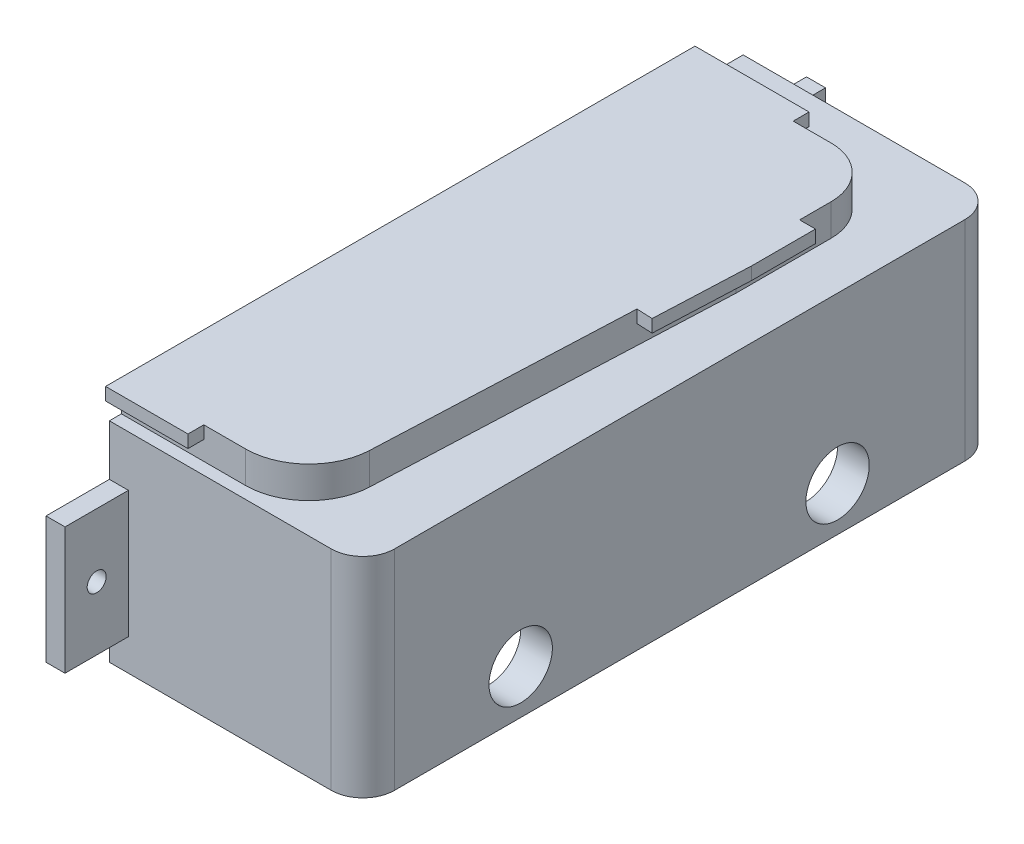
from build123d import *

# Parameters (mm, degrees)
SKETCH8_R                        = 10
BOSS_EXTRUDE6_DEPTH              = 5
BOSS_EXTRUDE7_START              = 5
BOSS_EXTRUDE7_DEPTH              = 5
EXTRUDE_THIN4_DEPTH              = 8
EXTRUDE_THIN4_DEPTH_BACK         = 20
SKETCH2_W                        = 70
SKETCH2_H                        = 90
BOSS_EXTRUDE8_DEPTH              = 5
BOSS_EXTRUDE9_DEPTH              = 5
BOSS_EXTRUDE10_REACH             = 81.849
SKETCH13_W                       = 6.5
SKETCH13_H                       = 17.8
SKETCH13_W_2                     = 6.3
BOSS_EXTRUDE10_DIRECTION_2_REACH = 81.849
SKETCH15_R                       = 2
CUT_EXTRUDE1_DEPTH               = 17.8
SKETCH17_W                       = 36
SKETCH17_H                       = 3
SKETCH17_W_2                     = 26
BOSS_EXTRUDE11_DEPTH             = 2
SKETCH18_W                       = 36
SKETCH18_H                       = 3
SKETCH18_W_2                     = 26
BOSS_EXTRUDE12_DEPTH             = 2
BOSS_EXTRUDE13_DEPTH             = 3
BOSS_EXTRUDE13_DEPTH_BACK        = 3
SKETCH19_W                       = 10
SKETCH19_H                       = 20
SKETCH19_R                       = 1.5
SKETCH21_R                       = 2.5
CUT_EXTRUDE5_DEPTH               = 8
SKETCH23_R                       = 2.5
CUT_EXTRUDE6_DEPTH               = 8
SKETCH24_W                       = 150
SKETCH24_H                       = 150
CUT_EXTRUDE7_DEPTH               = 85.574286873
SKETCH25_W                       = 150
SKETCH25_H                       = 150
CUT_EXTRUDE8_DEPTH               = 87.935665869
SKETCH26_W                       = 7.16
SKETCH26_H                       = 6.5
SKETCH26_W_2                     = 6.3
SKETCH26_H_2                     = 6.3
BOSS_EXTRUDE14_DEPTH             = 6.1
SKETCH27_R                       = 2
CUT_EXTRUDE9_DEPTH               = 8
SKETCH28_W                       = 15
SKETCH28_H                       = 13.4
BOSS_EXTRUDE15_DEPTH             = 15
CUT_EXTRUDE10_DEPTH              = 87.935665869
CUT_EXTRUDE10_DEPTH_BACK         = 87.935665869
SKETCH29_R                       = 5


with BuildPart() as part:
    # Sketch8 → Boss-Extrude6 (new body)
    with BuildSketch(Plane(origin=(0, 0, 0), x_dir=(-1, 0, 0), z_dir=(0, 1, 0))):
        with BuildLine():
            Line((32, -36), (32, -21))
            Line((32, -21), (29.579603504, 34.436193874))
            ThreePointArc((29.579603504, 34.436193874), (26.504251846, 41.223639621), (19.589121288, 44))
            Line((19.589121288, 44), (-19.589121288, 44))
            ThreePointArc((-19.589121288, 44), (-26.504251846, 41.223639621), (-29.579603504, 34.436193874))
            Line((-29.579603504, 34.436193874), (-32, -21))
            Line((-32, -21), (-32, -36))
            ThreePointArc((-32, -36), (-29.656854249, -41.656854249), (-24, -44))
            Line((-24, -44), (24, -44))
            ThreePointArc((24, -44), (29.656854249, -41.656854249), (32, -36))
        make_face()
        with Locations(Location((15.9, 11.8, 0), (0, 0, 90))):
            Circle(SKETCH8_R, mode=Mode.SUBTRACT)
        with Locations(Location((-15.9, 11.8, 0), (0, 0, 90))):
            Circle(SKETCH8_R, mode=Mode.SUBTRACT)
        with Locations(Location((15.9, -20, 0), (0, 0, 90))):
            Circle(SKETCH8_R, mode=Mode.SUBTRACT)
        with Locations(Location((-15.9, -20, 0), (0, 0, 90))):
            Circle(SKETCH8_R, mode=Mode.SUBTRACT)
    extrude(amount=-BOSS_EXTRUDE6_DEPTH)

    # Sketch1 → Boss-Extrude7 (add)
    # profile 1 of 2: a face of its own
    with BuildSketch(Plane(origin=(0, 0, 0), x_dir=(1, 0, 0), z_dir=(0, 1, 0)).offset(BOSS_EXTRUDE7_START)):
        with BuildLine():
            Line((-35, 54.1), (35, 54.1))
            ThreePointArc((35, 54.1), (38.535533906, 52.635533906), (40, 49.1))
            Line((40, 49.1), (40, -40.9))
            ThreePointArc((40, -40.9), (38.535533906, -44.435533906), (35, -45.9))
            Line((35, -45.9), (-35, -45.9))
            ThreePointArc((-35, -45.9), (-38.535533906, -44.435533906), (-40, -40.9))
            Line((-40, -40.9), (-40, 49.1))
            ThreePointArc((-40, 49.1), (-38.535533906, 52.635533906), (-35, 54.1))
        make_face()
        with BuildLine():
            ThreePointArc((32, 36), (29.656854249, 41.656854249), (24, 44))
            Line((24, 44), (-24, 44))
            ThreePointArc((-24, 44), (-29.656854249, 41.656854249), (-32, 36))
            Line((-32, 36), (-32, 21))
            Line((-32, 21), (-29.579603504, -34.436193874))
            ThreePointArc((-29.579603504, -34.436193874), (-26.504251846, -41.223639621), (-19.589121288, -44))
            Line((-19.589121288, -44), (19.589121288, -44))
            ThreePointArc((19.589121288, -44), (26.504251846, -41.223639621), (29.579603504, -34.436193874))
            Line((29.579603504, -34.436193874), (32, 21))
            Line((32, 21), (32, 36))
        make_face(mode=Mode.SUBTRACT)
    # profile 2 of 2: a face of its own
    with BuildSketch(Plane(origin=(0, 0, 0), x_dir=(1, 0, 0), z_dir=(0, 1, 0)).offset(BOSS_EXTRUDE7_START)):
        with BuildLine():
            Line((32, 36), (32, 21))
            Line((32, 21), (29.579603504, -34.436193874))
            ThreePointArc((29.579603504, -34.436193874), (26.504251846, -41.223639621), (19.589121288, -44))
            Line((19.589121288, -44), (-19.589121288, -44))
            ThreePointArc((-19.589121288, -44), (-26.504251846, -41.223639621), (-29.579603504, -34.436193874))
            Line((-29.579603504, -34.436193874), (-32, 21))
            Line((-32, 21), (-32, 36))
            ThreePointArc((-32, 36), (-29.656854249, 41.656854249), (-24, 44))
            Line((-24, 44), (24, 44))
            ThreePointArc((24, 44), (29.656854249, 41.656854249), (32, 36))
        make_face()
        with BuildLine():
            ThreePointArc((-24, 41), (-27.535533906, 39.535533906), (-29, 36))
            Line((-29, 36), (-29, 21.065460233))
            Line((-29, 21.065460233), (-26.582458839, -34.305335712))
            ThreePointArc((-26.582458839, -34.305335712), (-24.429712679, -39.056547734), (-19.589121288, -41))
            Line((-19.589121288, -41), (19.589121288, -41))
            ThreePointArc((19.589121288, -41), (24.429712679, -39.056547734), (26.582458839, -34.305335712))
            Line((26.582458839, -34.305335712), (29, 21.065460233))
            Line((29, 21.065460233), (29, 36))
            ThreePointArc((29, 36), (27.535533906, 39.535533906), (24, 41))
            Line((24, 41), (-24, 41))
        make_face(mode=Mode.SUBTRACT)
    extrude(amount=-BOSS_EXTRUDE7_DEPTH)

    # Sketch17 → Boss-Extrude11 (add)
    with BuildSketch(Plane(origin=(0, -5, 0), x_dir=(1, 0, 0), z_dir=(0, 1, 0))):
        with Locations((0, 45)):
            Rectangle(SKETCH17_W, SKETCH17_H)
        with Locations((0, -45)):
            Rectangle(SKETCH17_W_2, SKETCH17_H)
        Polygon((-31.5, 21.010910039), (-30.84570919, 6.025186715), (-33.842853854, 5.894328553), (-34.5, 20.945449806), (-34.5, 31.010910039), (-31.5, 31.010910039), align=None)
        Polygon((31.5, 21.010910039), (31.5, 31.010910039), (34.5, 31.010910039), (34.5, 20.945449806), (33.842853854, 5.894328553), (30.84570919, 6.025186715), align=None)
    extrude(amount=BOSS_EXTRUDE11_DEPTH)

    # Sketch24 → Cut-Extrude7 (cut, through all)
    with BuildSketch(Plane(origin=(0, 5, 0), x_dir=(1, 0, 0), z_dir=(0, 1, 0))):
        Rectangle(SKETCH24_W, SKETCH24_H)
    extrude(amount=-CUT_EXTRUDE7_DEPTH, mode=Mode.SUBTRACT)


with BuildPart() as body_2:
    # Sketch2 → Extrude-Thin4 (new, two sides: drawn at the far end of the back side and taken through both)
    with BuildSketch(Plane(origin=(0, 25, 0), x_dir=(1, 0, 0), z_dir=(0, 1, 0)).offset(-EXTRUDE_THIN4_DEPTH_BACK)):
        with BuildLine():
            Line((-40, 49.1), (-40, -40.9))
            ThreePointArc((-40, -40.9), (-38.535533906, -44.435533906), (-35, -45.9))
            Line((-35, -45.9), (35, -45.9))
            ThreePointArc((35, -45.9), (38.535533906, -44.435533906), (40, -40.9))
            Line((40, -40.9), (40, 49.1))
            ThreePointArc((40, 49.1), (38.535533906, 52.635533906), (35, 54.1))
            Line((35, 54.1), (-35, 54.1))
            ThreePointArc((-35, 54.1), (-38.535533906, 52.635533906), (-40, 49.1))
        make_face()
        with Locations((0, 4.1)):
            Rectangle(SKETCH2_W, SKETCH2_H, mode=Mode.SUBTRACT)
    extrude(amount=EXTRUDE_THIN4_DEPTH + EXTRUDE_THIN4_DEPTH_BACK)

    # Sketch13 → Boss-Extrude10 (add, up to next)
    with BuildSketch(Plane(origin=(0, 0, 0), x_dir=(0, 0, -1), z_dir=(1, 0, 0)), mode=Mode.PRIVATE) as boss_extrude10_sk1:
        with Locations((45.85, 20)):
            Rectangle(SKETCH13_W, SKETCH13_H)
    boss_extrude10_tool1 = extrude(boss_extrude10_sk1.sketch, amount=BOSS_EXTRUDE10_REACH, mode=Mode.PRIVATE) - body_2.part
    # Sketch13 → Boss-Extrude10 (add, up to next)
    with BuildSketch(Plane(origin=(0, 0, 0), x_dir=(0, 0, -1), z_dir=(1, 0, 0)), mode=Mode.PRIVATE) as boss_extrude10_sk2:
        with Locations((-37.75, 20)):
            Rectangle(SKETCH13_W_2, SKETCH13_H)
    boss_extrude10_tool2 = extrude(boss_extrude10_sk2.sketch, amount=BOSS_EXTRUDE10_REACH, mode=Mode.PRIVATE) - body_2.part
    add(boss_extrude10_tool1.solids().sort_by_distance((0, 20, -45.85))[0])
    add(boss_extrude10_tool2.solids().sort_by_distance((0, 20, 37.75))[0])

    # Sketch13 → Boss-Extrude10 direction 2 (add, up to next)
    with BuildSketch(Plane(origin=(0, 0, 0), x_dir=(0, 0, -1), z_dir=(1, 0, 0)), mode=Mode.PRIVATE) as boss_extrude10_direction_2_sk1:
        with Locations((45.85, 20)):
            Rectangle(SKETCH13_W, SKETCH13_H)
    boss_extrude10_direction_2_tool1 = extrude(boss_extrude10_direction_2_sk1.sketch, amount=-BOSS_EXTRUDE10_DIRECTION_2_REACH, mode=Mode.PRIVATE) - body_2.part
    # Sketch13 → Boss-Extrude10 direction 2 (add, up to next)
    with BuildSketch(Plane(origin=(0, 0, 0), x_dir=(0, 0, -1), z_dir=(1, 0, 0)), mode=Mode.PRIVATE) as boss_extrude10_direction_2_sk2:
        with Locations((-37.75, 20)):
            Rectangle(SKETCH13_W_2, SKETCH13_H)
    boss_extrude10_direction_2_tool2 = extrude(boss_extrude10_direction_2_sk2.sketch, amount=-BOSS_EXTRUDE10_DIRECTION_2_REACH, mode=Mode.PRIVATE) - body_2.part
    add(boss_extrude10_direction_2_tool1.solids().sort_by_distance((0, 20, -45.85))[0])
    add(boss_extrude10_direction_2_tool2.solids().sort_by_distance((0, 20, 37.75))[0])

    # Sketch15 → Cut-Extrude1 (cut)
    with BuildSketch(Plane.XZ.offset(-11.1)):
        with Locations((-22, -44)):
            Circle(SKETCH15_R)
        with Locations((-10, -44)):
            Circle(SKETCH15_R)
        with Locations((-22, 36)):
            Circle(SKETCH15_R)
        with Locations((-10, 36)):
            Circle(SKETCH15_R)
        with Locations((10, 36)):
            Circle(SKETCH15_R)
        with Locations((22, 36)):
            Circle(SKETCH15_R)
        with Locations((10, -44)):
            Circle(SKETCH15_R)
        with Locations((22, -44)):
            Circle(SKETCH15_R)
    extrude(amount=-CUT_EXTRUDE1_DEPTH, mode=Mode.SUBTRACT)

    # Sketch19 → Boss-Extrude13 (add, two sides: drawn at the far end of the back side and taken through both)
    # profile 1 of 2: a face of its own
    with BuildSketch(Plane(origin=(0, 0, 0), x_dir=(0, 0, -1), z_dir=(1, 0, 0)).offset(-BOSS_EXTRUDE13_DEPTH_BACK)):
        with Locations((-50.9, 20)):
            Rectangle(SKETCH19_W, SKETCH19_H)
        with Locations((-50.9, 20)):
            Circle(SKETCH19_R, mode=Mode.SUBTRACT)
    # profile 2 of 2: a face of its own
    with BuildSketch(Plane(origin=(0, 0, 0), x_dir=(0, 0, -1), z_dir=(1, 0, 0)).offset(-BOSS_EXTRUDE13_DEPTH_BACK)):
        with Locations((59.1, 20)):
            Rectangle(SKETCH19_W, SKETCH19_H)
        with Locations((59.1, 20)):
            Circle(SKETCH19_R, mode=Mode.SUBTRACT)
    extrude(amount=BOSS_EXTRUDE13_DEPTH + BOSS_EXTRUDE13_DEPTH_BACK)

    # Sketch21 → Cut-Extrude5 (cut)
    with BuildSketch(Plane.XY.offset(38)):
        with Locations((0, 20)):
            Circle(SKETCH21_R)
    extrude(amount=CUT_EXTRUDE5_DEPTH, mode=Mode.SUBTRACT)

    # Sketch23 → Cut-Extrude6 (cut)
    with BuildSketch(Plane.XY.offset(-46.2)):
        with Locations((0, 20)):
            Circle(SKETCH23_R)
    extrude(amount=-CUT_EXTRUDE6_DEPTH, mode=Mode.SUBTRACT)


with BuildPart() as body_3:
    # Sketch10 → Boss-Extrude8 (new body)
    with BuildSketch(Plane(origin=(0, 38, 0), x_dir=(1, 0, 0), z_dir=(0, 1, 0))):
        with BuildLine():
            Line((-32, 36), (-32, 21))
            Line((-32, 21), (-29.579603504, -34.436193874))
            ThreePointArc((-29.579603504, -34.436193874), (-26.504251846, -41.223639621), (-19.589121288, -44))
            Line((-19.589121288, -44), (19.589121288, -44))
            ThreePointArc((19.589121288, -44), (26.504251846, -41.223639621), (29.579603504, -34.436193874))
            Line((29.579603504, -34.436193874), (32, 21))
            Line((32, 21), (32, 36))
            ThreePointArc((32, 36), (29.656854249, 41.656854249), (24, 44))
            Line((24, 44), (-24, 44))
            ThreePointArc((-24, 44), (-29.656854249, 41.656854249), (-32, 36))
        make_face()
    extrude(amount=BOSS_EXTRUDE8_DEPTH)

    # Sketch11 → Boss-Extrude9 (add)
    with BuildSketch(Plane(origin=(0, 38, 0), x_dir=(1, 0, 0), z_dir=(0, 1, 0))):
        with BuildLine():
            Line((-35, -45.9), (35, -45.9))
            ThreePointArc((35, -45.9), (38.535533906, -44.435533906), (40, -40.9))
            Line((40, -40.9), (40, 49.1))
            ThreePointArc((40, 49.1), (38.535533906, 52.635533906), (35, 54.1))
            Line((35, 54.1), (-35, 54.1))
            ThreePointArc((-35, 54.1), (-38.535533906, 52.635533906), (-40, 49.1))
            Line((-40, 49.1), (-40, -40.9))
            ThreePointArc((-40, -40.9), (-38.535533906, -44.435533906), (-35, -45.9))
        make_face()
    extrude(amount=-BOSS_EXTRUDE9_DEPTH)

    # Sketch18 → Boss-Extrude12 (add)
    with BuildSketch(Plane(origin=(0, 43, 0), x_dir=(1, 0, 0), z_dir=(0, 1, 0))):
        with Locations((0, 45)):
            Rectangle(SKETCH18_W, SKETCH18_H)
        with Locations((0, -45)):
            Rectangle(SKETCH18_W_2, SKETCH18_H)
        Polygon((-31.5, 21.010910039), (-30.84570919, 6.025186715), (-33.842853854, 5.894328553), (-34.5, 20.945449806), (-34.5, 31.010910039), (-31.5, 31.010910039), align=None)
        Polygon((31.5, 21.010910039), (31.5, 31.010910039), (34.5, 31.010910039), (34.5, 20.945449806), (33.842853854, 5.894328553), (30.84570919, 6.025186715), align=None)
    extrude(amount=-BOSS_EXTRUDE12_DEPTH)


with BuildPart() as cut_extrude8_tool:
    # Sketch25 → Cut-Extrude8 (new, through all)
    with BuildSketch(Plane(origin=(0, 0, 0), x_dir=(0, 0, -1), z_dir=(1, 0, 0))):
        Rectangle(SKETCH25_W, SKETCH25_H)
    extrude(amount=-CUT_EXTRUDE8_DEPTH)


with BuildPart() as body_2_1:
    add(body_2.part)

    # Cut-Extrude8: cut by cut_extrude8_tool
    add(cut_extrude8_tool.part, mode=Mode.SUBTRACT)

    # Sketch26 → Boss-Extrude14 (add)
    with BuildSketch(Plane.XZ.offset(-11.1)):
        with Locations((31.42, -45.85)):
            Rectangle(SKETCH26_W, SKETCH26_H)
        with Locations((31.85, 37.75)):
            Rectangle(SKETCH26_W_2, SKETCH26_H_2)
    extrude(amount=BOSS_EXTRUDE14_DEPTH)

    # Sketch27 → Cut-Extrude9 (cut)
    with BuildSketch(Plane.XZ.offset(-5)):
        with Locations(Location((35, 40.9, 0), (0, 0, 270))):
            Circle(SKETCH27_R)
        with Locations(Location((35, -49.1, 0), (0, 0, 270))):
            Circle(SKETCH27_R)
    extrude(amount=-CUT_EXTRUDE9_DEPTH, mode=Mode.SUBTRACT)


with BuildPart() as body_3_1:
    add(body_3.part)

    # Cut-Extrude8: cut by cut_extrude8_tool
    add(cut_extrude8_tool.part, mode=Mode.SUBTRACT)


    add(body_2_1.part)  # Boss-Extrude15 merges body 2
    # Sketch28 → Boss-Extrude15 (add)
    with BuildSketch(Plane.XZ.offset(-33)):
        with Locations((16, -4.1)):
            Rectangle(SKETCH28_W, SKETCH28_H)
    extrude(amount=BOSS_EXTRUDE15_DEPTH)

    # Sketch29 → Cut-Extrude10 (cut, two sides: drawn at the far end of the back side and taken through both)
    with BuildSketch(Plane.ZY.offset(-CUT_EXTRUDE10_DEPTH_BACK)):
        with Locations((-29, 12)):
            Circle(SKETCH29_R)
        with Locations((21, 12)):
            Circle(SKETCH29_R)
    extrude(amount=CUT_EXTRUDE10_DEPTH + CUT_EXTRUDE10_DEPTH_BACK, mode=Mode.SUBTRACT)


solid = body_3_1.part
